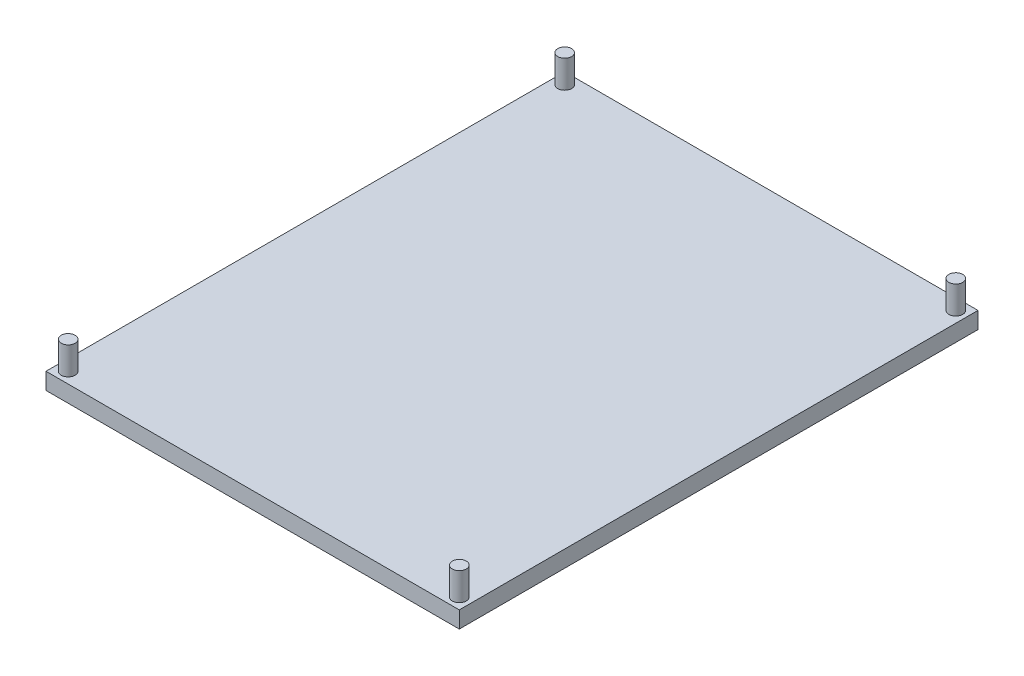
from build123d import *

# Parameters (mm, degrees)
SKETCH1_W           = 74.5
SKETCH1_H           = 93.5
BOSS_EXTRUDE1_DEPTH = 3
SKETCH2_R           = 1.25
BOSS_EXTRUDE2_DEPTH = 5


with BuildPart() as part:
    # Sketch1 → Boss-Extrude1 (new body)
    with BuildSketch(Plane(origin=(0, 0, 0), x_dir=(1, 0, 0), z_dir=(0, 1, 0))):
        Rectangle(SKETCH1_W, SKETCH1_H)
    extrude(amount=BOSS_EXTRUDE1_DEPTH)

    # Sketch2 → Boss-Extrude2 (add)
    with BuildSketch(Plane(origin=(0, 3, 0), x_dir=(1, 0, 0), z_dir=(0, 1, 0))):
        with Locations(Location((-35.25, 44.75, 0), (0, 0, 270))):
            Circle(SKETCH2_R)
        with Locations(Location((35.25, 44.75, 0), (0, 0, 270))):
            Circle(SKETCH2_R)
        with Locations(Location((-35.25, -44.75, 0), (0, 0, 270))):
            Circle(SKETCH2_R)
        with Locations(Location((35.25, -44.75, 0), (0, 0, 270))):
            Circle(SKETCH2_R)
    extrude(amount=BOSS_EXTRUDE2_DEPTH)


solid = part.part
